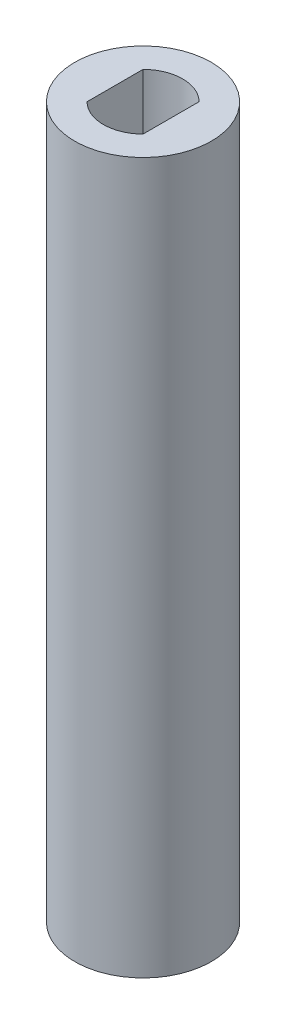
from build123d import *

# Parameters (mm, degrees)
SKETCH1_R           = 5
BOSS_EXTRUDE1_DEPTH = 52


with BuildPart() as part:
    # Sketch1 → Boss-Extrude1 (new body)
    with BuildSketch(Plane(origin=(0, 0, 0), x_dir=(1, 0, 0), z_dir=(0, 1, 0))):
        with Locations(Location((0, 0, 0), (0, 0, 90))):
            Circle(SKETCH1_R)
        with BuildLine():
            Line((-2.05, 2.05121915), (-2.05, -2.05121915))
            ThreePointArc((-2.05, -2.05121915), (0, -2.9), (2.05, -2.05121915))
            Line((2.05, -2.05121915), (2.05, 2.05121915))
            ThreePointArc((2.05, 2.05121915), (0, 2.9), (-2.05, 2.05121915))
        make_face(mode=Mode.SUBTRACT)
    extrude(amount=BOSS_EXTRUDE1_DEPTH)


solid = part.part
